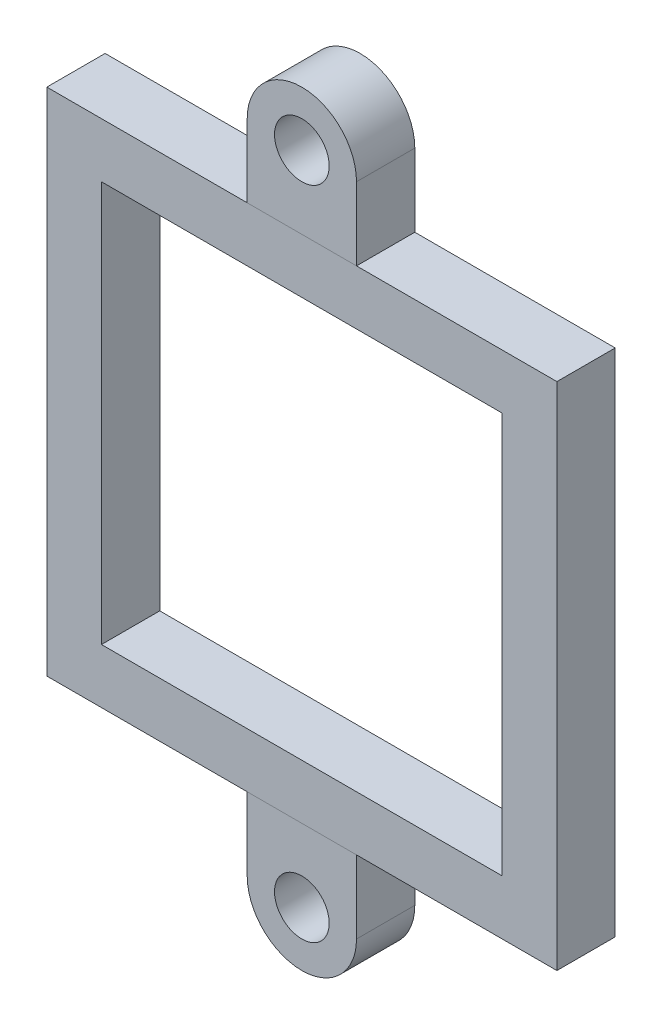
from build123d import *

# Parameters (mm, degrees)
SKETCH_2_W          = 14
SKETCH_2_H          = 14
EXTRUDE_1_DEPTH     = 1.6
SKETCH_3_W          = 3
SKETCH_3_H          = 1.6
EXTRUDE_2_DEPTH     = 3.5
CUT_EXTRUDE_1_DEPTH = 4
SKETCH_5_R          = 0.75
CUT_EXTRUDE_2_DEPTH = 4
SKETCH_6_W          = 11
SKETCH_6_H          = 11
CUT_EXTRUDE_3_DEPTH = 10


with BuildPart() as part:
    # 草图2 → 凸台-拉伸1 (new body)
    with BuildSketch(Plane.XY):
        Rectangle(SKETCH_2_W, SKETCH_2_H)
    extrude(amount=EXTRUDE_1_DEPTH)

    # 草图6 → 切除-拉伸3 (cut)
    with BuildSketch(Plane(origin=(0, 0, 0), x_dir=(-1, 0, 0), z_dir=(0, 0, -1))):
        Rectangle(SKETCH_6_W, SKETCH_6_H)
    extrude(amount=-CUT_EXTRUDE_3_DEPTH, mode=Mode.SUBTRACT)


with BuildPart() as body_2:
    # 草图3 → 凸台-拉伸2 (new body)
    with BuildSketch(Plane.XZ.offset(7)):
        with Locations((0, 0.8)):
            Rectangle(SKETCH_3_W, SKETCH_3_H)
    extrude(amount=EXTRUDE_2_DEPTH)

    # 草图4 → 切除-拉伸1 (cut)
    with BuildSketch(Plane(origin=(0, 0, 0), x_dir=(-1, 0, 0), z_dir=(0, 0, -1))):
        with BuildLine():
            Line((1.5, -10.5), (1.5, -9))
            ThreePointArc((1.5, -9), (1.060660172, -10.060660172), (0, -10.5))
            Line((0, -10.5), (1.5, -10.5))
        make_face()
        with BuildLine():
            ThreePointArc((0, -10.5), (-1.060660172, -10.060660172), (-1.5, -9))
            Line((-1.5, -9), (-1.5, -10.5))
            Line((-1.5, -10.5), (0, -10.5))
        make_face()
    extrude(amount=-CUT_EXTRUDE_1_DEPTH, mode=Mode.SUBTRACT)

    # 草图5 → 切除-拉伸2 (cut)
    with BuildSketch(Plane(origin=(0, 0, 0), x_dir=(-1, 0, 0), z_dir=(0, 0, -1))):
        with Locations((0, -9)):
            Circle(SKETCH_5_R)
    extrude(amount=-CUT_EXTRUDE_2_DEPTH, mode=Mode.SUBTRACT)


with BuildPart() as body_3:
    # 镜向7: mirrored copy
    add(body_2.part.mirror(Plane.ZX))


solid = Compound([part.part, body_2.part, body_3.part])
